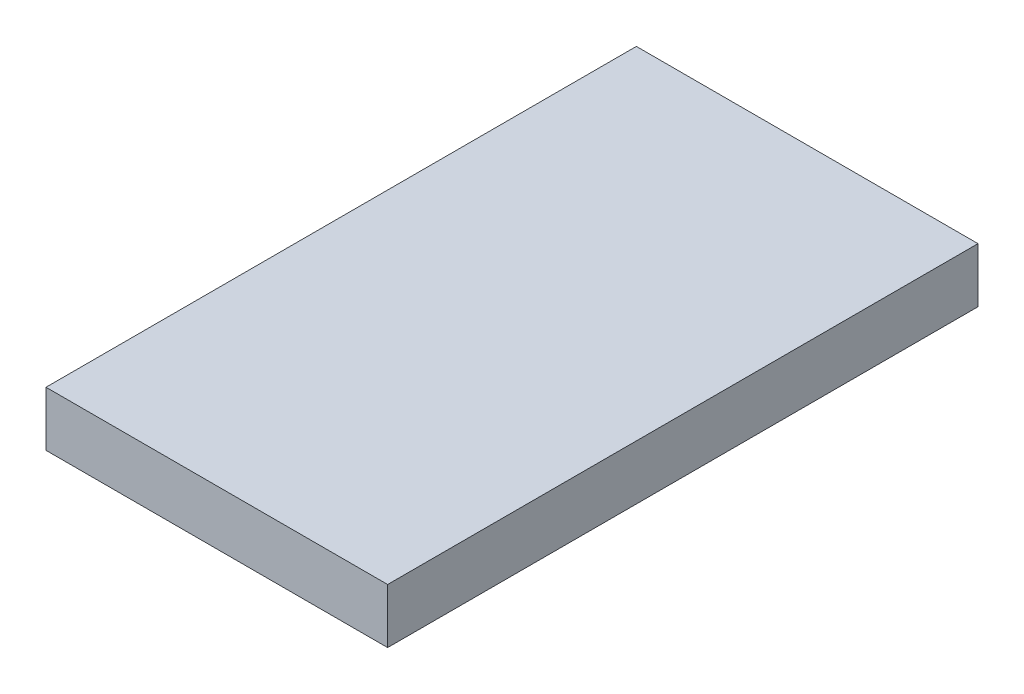
from build123d import *

# Parameters (mm, degrees)
SKETCH_2_W      = 10
SKETCH_2_H      = 17.280767805
EXTRUDE_1_DEPTH = 1.6
EXTRUDE_2_DEPTH = 0.01


with BuildPart() as part:
    # Эскиз2 → Бобышка-Вытянуть1 (new body)
    with BuildSketch(Plane(origin=(0, 0, 0), x_dir=(1, 0, 0), z_dir=(0, 1, 0))):
        with Locations((12.452403324, -13.837242614)):
            Rectangle(SKETCH_2_W, SKETCH_2_H)
    extrude(amount=EXTRUDE_1_DEPTH)

    # Эскиз1 → Бобышка-Вытянуть2 (add)
    with BuildSketch(Plane(origin=(0, 0, 0), x_dir=(1, 0, 0), z_dir=(0, 1, 0))):
        Polygon((12.273882011, -21.477626516), (12.884093179, -21.477626516), (12.884093179, -16.477626516), (16.618556013, -16.477626516), (16.618556013, -12.422038386), (9.29364382, -12.422038386), (9.29364382, -10.258848538), (16.618556013, -10.258848538), (16.618556013, -6.196858711), (9.29364382, -6.196858711), (9.29364382, -7.134240978), (15.783213366, -7.134240978), (15.783213366, -9.297430827), (8.452403324, -9.297430827), (8.452403324, -13.335385211), (15.783213366, -13.335385211), (15.783213366, -15.594716831), (9.29364382, -15.594716831), (9.29364382, -16.477626516), (12.273882011, -16.477626516), align=None)
    extrude(amount=-EXTRUDE_2_DEPTH)


solid = part.part
